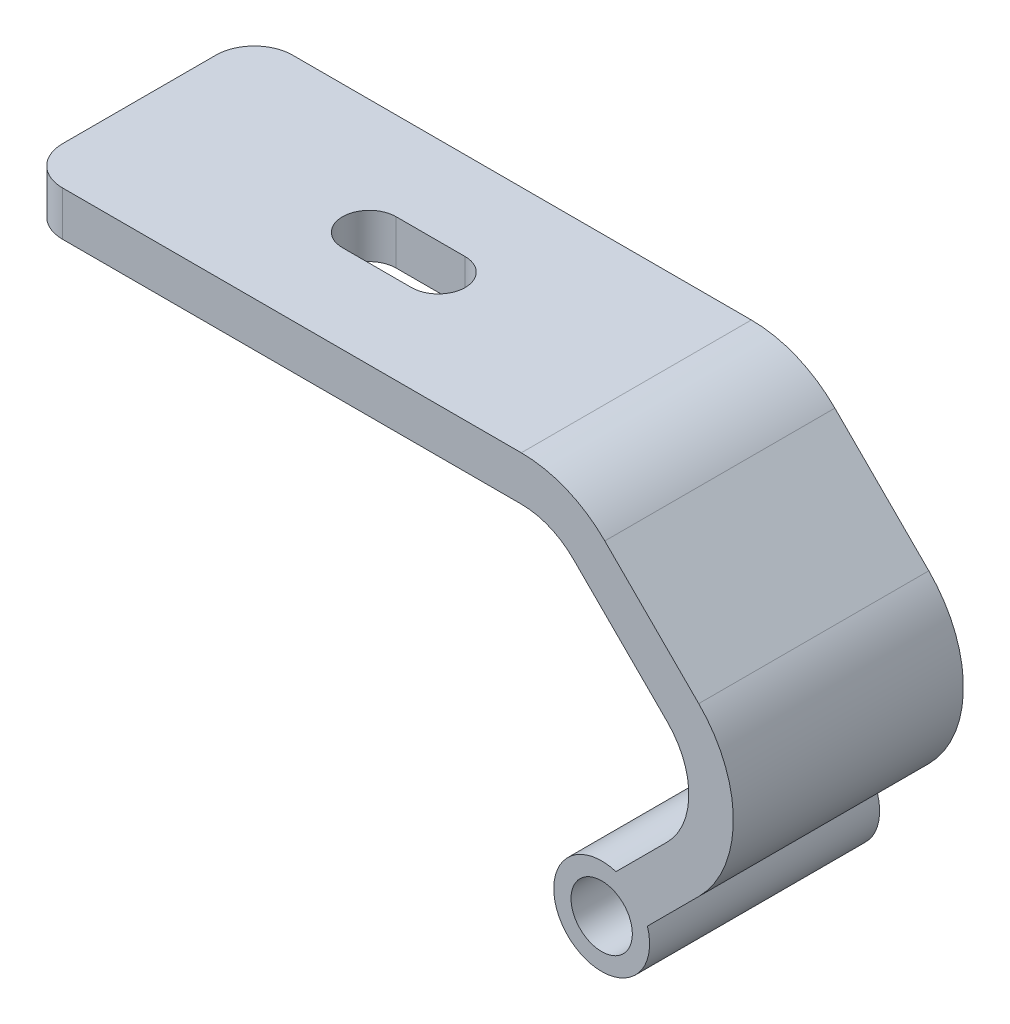
from build123d import *

# Parameters (mm, degrees)
SKETCH1_R           = 4
BOSS_EXTRUDE1_DEPTH = 15
CUT_EXTRUDE1_REACH  = 83.718
FILLET1_R           = 5


with BuildPart() as part:
    # Sketch1 → Boss-Extrude1 (new, symmetric)
    with BuildSketch(Plane.XY):
        with BuildLine():
            Line((-32.411165235, -2.9), (32.411165235, -2.9))
            ThreePointArc((32.411165235, -2.9), (36.084926186, -3.630756488), (39.199390335, -5.711774901))
            Line((39.199390335, -5.711774901), (51.448127676, -17.960512242))
            ThreePointArc((51.448127676, -17.960512242), (54.259902577, -24.748737342), (51.448127676, -31.536962441))
            Line((51.448127676, -31.536962441), (44.756401435, -38.228688682))
            ThreePointArc((44.756401435, -38.228688682), (38.472718241, -48.613591207), (48.857620766, -42.329908013))
            Line((48.857620766, -42.329908013), (55.549347007, -35.638181772))
            ThreePointArc((55.549347007, -35.638181772), (60.059902577, -24.748737342), (55.549347007, -13.859292911))
            Line((55.549347007, -13.859292911), (43.300609665, -1.61055557))
            ThreePointArc((43.300609665, -1.61055557), (38.304490094, 1.727744801), (32.411165235, 2.9))
            Line((32.411165235, 2.9), (-32.411165235, 2.9))
            Line((-32.411165235, 2.9), (-32.411165235, -2.9))
        make_face()
        with Locations((42.892135624, -44.194173824)):
            Circle(SKETCH1_R, mode=Mode.SUBTRACT)
    extrude(amount=BOSS_EXTRUDE1_DEPTH, both=True)

    # Sketch2 → Cut-Extrude1 (cut, up to next)
    with BuildSketch(Plane(origin=(0, 2.9, 0), x_dir=(1, 0, 0), z_dir=(0, 1, 0)), mode=Mode.PRIVATE) as cut_extrude1_sk1:
        with BuildLine():
            Line((-2.411165235, 3.5), (6.588834765, 3.5))
            ThreePointArc((6.588834765, 3.5), (10.088834765, 0), (6.588834765, -3.5))
            Line((6.588834765, -3.5), (-2.411165235, -3.5))
            ThreePointArc((-2.411165235, -3.5), (-5.911165235, 0), (-2.411165235, 3.5))
        make_face()
    cut_extrude1_tool1 = extrude(cut_extrude1_sk1.sketch, amount=-CUT_EXTRUDE1_REACH, mode=Mode.PRIVATE) & part.part
    add(cut_extrude1_tool1.solids().sort_by_distance((2.088835, 2.9, 0))[0], mode=Mode.SUBTRACT)

    # Fillet1
    fillet1_edges = [part.edges().sort_by_distance(p)[0] for p in [
        (-32.411165235, 0, -15),
        (-32.411165235, 0, 15),
    ]]
    fillet(fillet1_edges, radius=FILLET1_R)


solid = part.part
